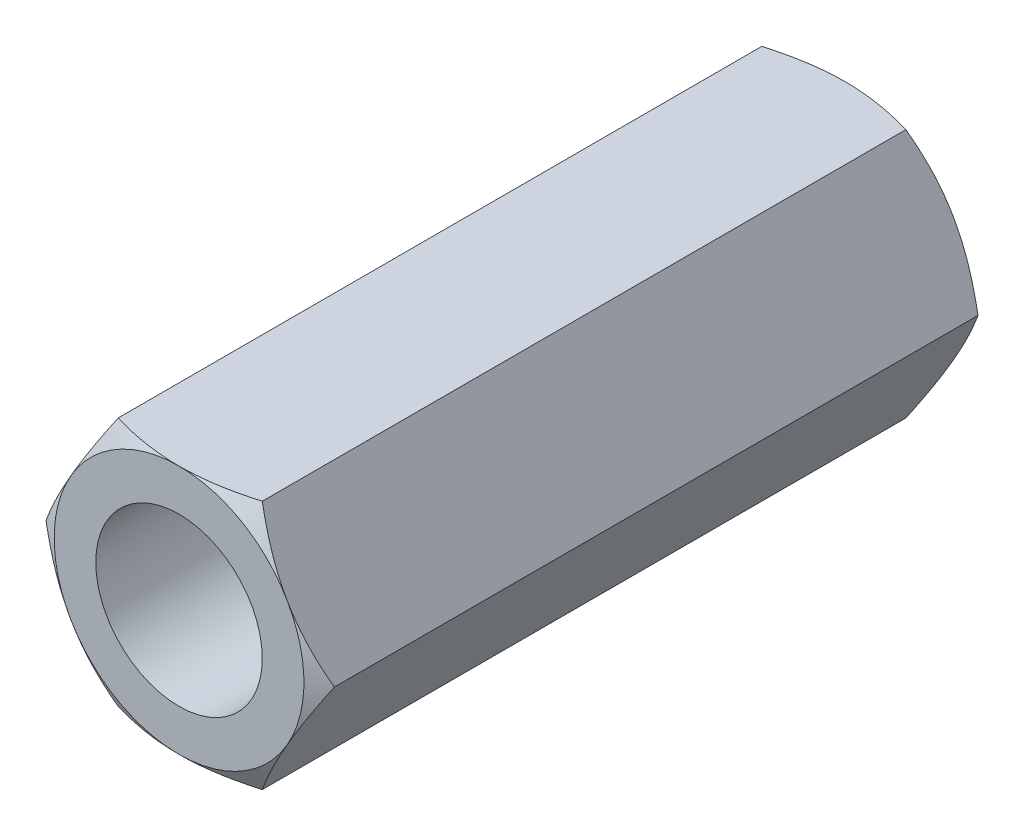
from build123d import *

# Parameters (mm, degrees)
SKETCH2_OUTSIDE_W               = 13.34
SKETCH2_OUTSIDE_H               = 13.34
CUT_EXTRUDE1_DEPTH              = 17.856007831
M4X0_7_TAPPED_HOLE1_D           = 3.3
M4X0_7_TAPPED_HOLE1_DEPTH       = 14.5
M4X0_7_TAPPED_HOLE1_CBORE_D     = 4
M4X0_7_TAPPED_HOLE1_CBORE_DEPTH = 13.1
M4X0_7_TAPPED_HOLE1_TIP         = 0.991420021
M4X0_7_TAPPED_HOLE2_D           = 3.3
M4X0_7_TAPPED_HOLE2_DEPTH       = 12.5
M4X0_7_TAPPED_HOLE2_CBORE_D     = 4
M4X0_7_TAPPED_HOLE2_CBORE_DEPTH = 11.1
M4X0_7_TAPPED_HOLE2_TIP         = 0.991420021


with BuildPart() as part:
    # Sketch1 → Revolve1 (revolve)
    with BuildSketch(Plane(origin=(0, 0, 0), x_dir=(0, 0, -1), z_dir=(1, 0, 0))):
        Polygon((-8, 0), (-8, 3), (-7.566987298, 3.75), (7.566987298, 3.75), (8, 3), (8, 0), align=None)
    revolve(axis=Axis((0, 0, 5.584882278), (0, 0, -1)))

    # Sketch2 outside → Cut-Extrude1 (cut, through all)
    with BuildSketch(Plane.XY.offset(8)):
        Rectangle(SKETCH2_OUTSIDE_W, SKETCH2_OUTSIDE_H)
        Polygon((1.732050808, -3), (3.464101615, 0), (1.732050808, 3), (-1.732050808, 3), (-3.464101615, 0), (-1.732050808, -3), align=None, mode=Mode.SUBTRACT)
    extrude(amount=-CUT_EXTRUDE1_DEPTH, mode=Mode.SUBTRACT)

    # M4x0.7 Tapped Hole1
    with Locations(Plane.XY.offset(8)):
        with Locations((0, 0)):
            CounterBoreHole(M4X0_7_TAPPED_HOLE1_D / 2, M4X0_7_TAPPED_HOLE1_CBORE_D / 2, M4X0_7_TAPPED_HOLE1_CBORE_DEPTH, depth=M4X0_7_TAPPED_HOLE1_DEPTH)
            with Locations((0, 0, -(M4X0_7_TAPPED_HOLE1_DEPTH + M4X0_7_TAPPED_HOLE1_TIP / 2))):  # 118° drill point
                Cone(0, M4X0_7_TAPPED_HOLE1_D / 2, M4X0_7_TAPPED_HOLE1_TIP, mode=Mode.SUBTRACT)

    # M4x0.7 Tapped Hole2
    with Locations(Plane(origin=(0, 0, -8), x_dir=(-1, 0, 0), z_dir=(0, 0, -1))):
        with Locations((0, 0)):
            CounterBoreHole(M4X0_7_TAPPED_HOLE2_D / 2, M4X0_7_TAPPED_HOLE2_CBORE_D / 2, M4X0_7_TAPPED_HOLE2_CBORE_DEPTH, depth=M4X0_7_TAPPED_HOLE2_DEPTH)
            with Locations((0, 0, -(M4X0_7_TAPPED_HOLE2_DEPTH + M4X0_7_TAPPED_HOLE2_TIP / 2))):  # 118° drill point
                Cone(0, M4X0_7_TAPPED_HOLE2_D / 2, M4X0_7_TAPPED_HOLE2_TIP, mode=Mode.SUBTRACT)


solid = part.part
